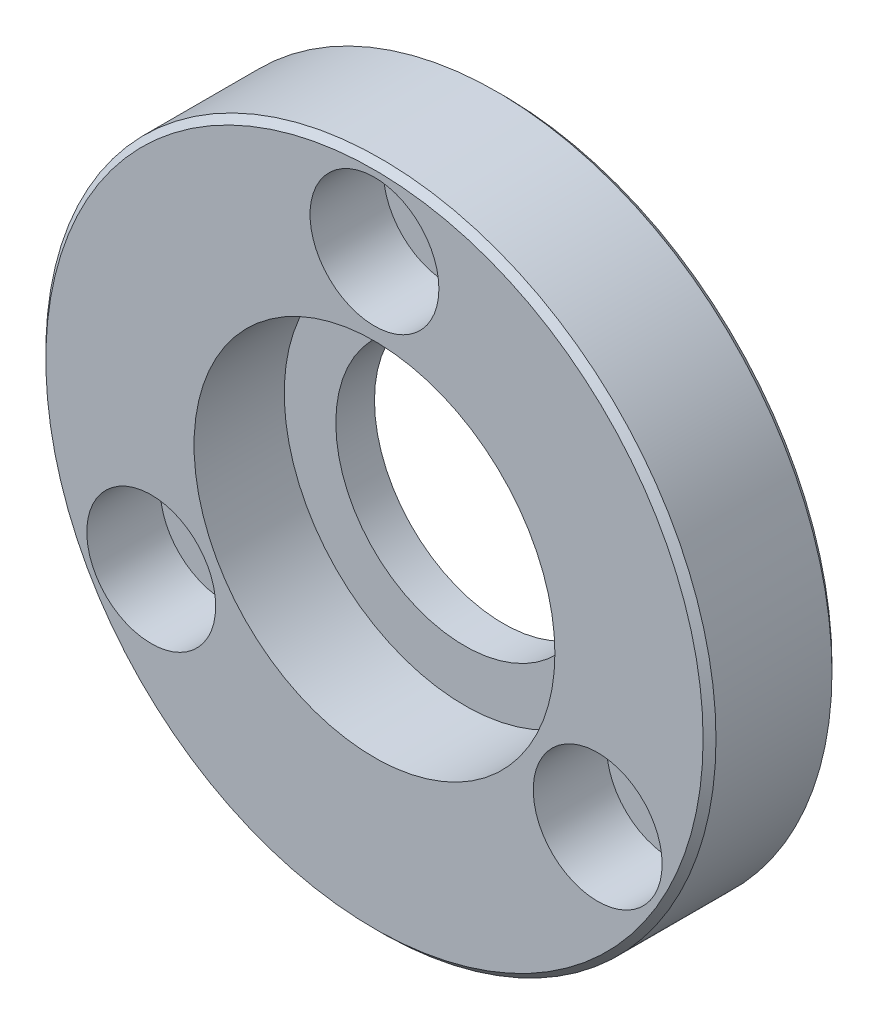
from build123d import *

# Parameters (mm, degrees)
SKETCH_1_R                = 26
EXTRUDE_1_DEPTH           = 5
SKETCH_2_R                = 14
CUT_EXTRUDE_1_DEPTH       = 7
SKETCH_3_R                = 10
CUT_EXTRUDE_2_DEPTH       = 38.429934544
HOLE_WIZARD_1_D           = 5.5
HOLE_WIZARD_1_CBORE_D     = 10
HOLE_WIZARD_1_CBORE_DEPTH = 5.7
CHAMFER_1_SIZE            = 0.5
PATTERN_CIRCULAR_1_COUNT  = 3


with BuildPart() as part:
    # 草图1 → 凸台-拉伸1 (new, symmetric)
    with BuildSketch(Plane.XY):
        Circle(SKETCH_1_R)
    extrude(amount=EXTRUDE_1_DEPTH, both=True)

    # 草图2 → 切除-拉伸1 (cut)
    with BuildSketch(Plane.XY.offset(5)):
        Circle(SKETCH_2_R)
    extrude(amount=-CUT_EXTRUDE_1_DEPTH, mode=Mode.SUBTRACT)

    # 草图3 → 切除-拉伸2 (cut, through all)
    with BuildSketch(Plane.XY.offset(-2)):
        Circle(SKETCH_3_R)
    extrude(amount=-CUT_EXTRUDE_2_DEPTH, mode=Mode.SUBTRACT)

    # 打孔尺寸根据内六角圆柱头螺钉的类型1 (through all)
    with Locations(Plane.XY.offset(5)):
        with Locations((0, 20)):
            hole_wizard_1 = CounterBoreHole(HOLE_WIZARD_1_D / 2, HOLE_WIZARD_1_CBORE_D / 2, HOLE_WIZARD_1_CBORE_DEPTH)

    # 倒角1
    chamfer_1_edges = [part.edges().sort_by_distance(p)[0] for p in [
        (-26, 0, -5),
        (-26, 0, 5),
    ]]
    chamfer(chamfer_1_edges, length=CHAMFER_1_SIZE)

    # 阵列(圆周)1: 打孔尺寸根据内六角圆柱头螺钉的类型1 ×3 about axis
    pattern_circular_1_axis = Axis((0, 0, 0), (0, 0, 1))
    for i in range(1, PATTERN_CIRCULAR_1_COUNT):
        add(hole_wizard_1.rotate(pattern_circular_1_axis, i * 360 / PATTERN_CIRCULAR_1_COUNT), mode=Mode.SUBTRACT)


solid = part.part
